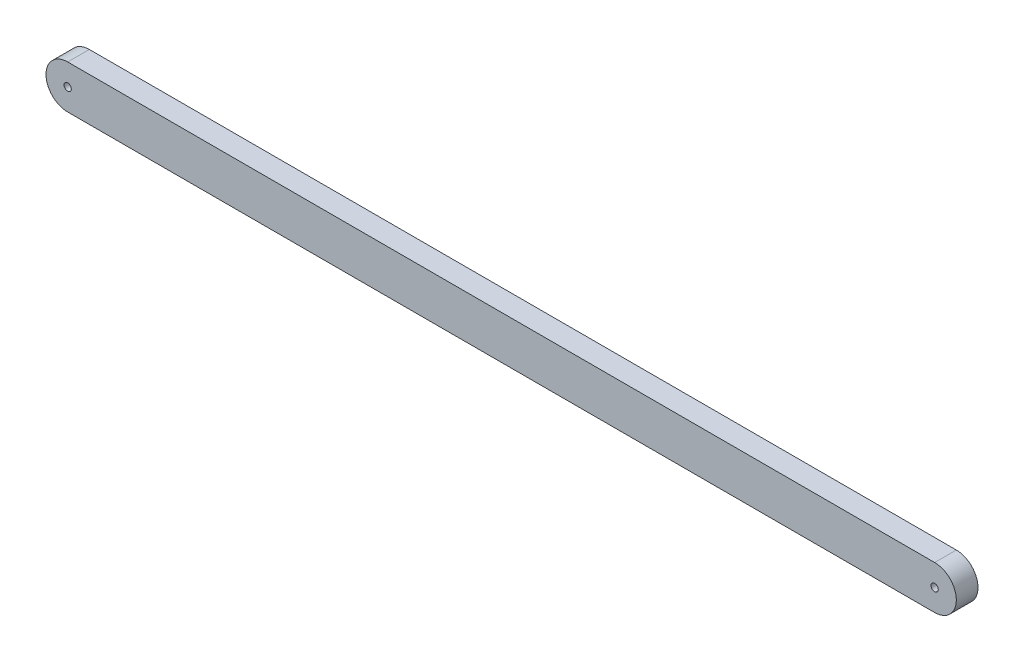
from build123d import *

# Parameters (mm, degrees)
SKETCH2_R           = 0.5
BOSS_EXTRUDE1_DEPTH = 3


with BuildPart() as part:
    # Sketch2 → Boss-Extrude1 (new body)
    with BuildSketch(Plane.XY):
        with BuildLine():
            Line((0, 3), (120, 3))
            ThreePointArc((120, 3), (123, 0), (120, -3))
            Line((120, -3), (0, -3))
            ThreePointArc((0, -3), (-3, 0), (0, 3))
        make_face()
        Circle(SKETCH2_R, mode=Mode.SUBTRACT)
        with Locations((120, 0)):
            Circle(SKETCH2_R, mode=Mode.SUBTRACT)
    extrude(amount=BOSS_EXTRUDE1_DEPTH)


solid = part.part
